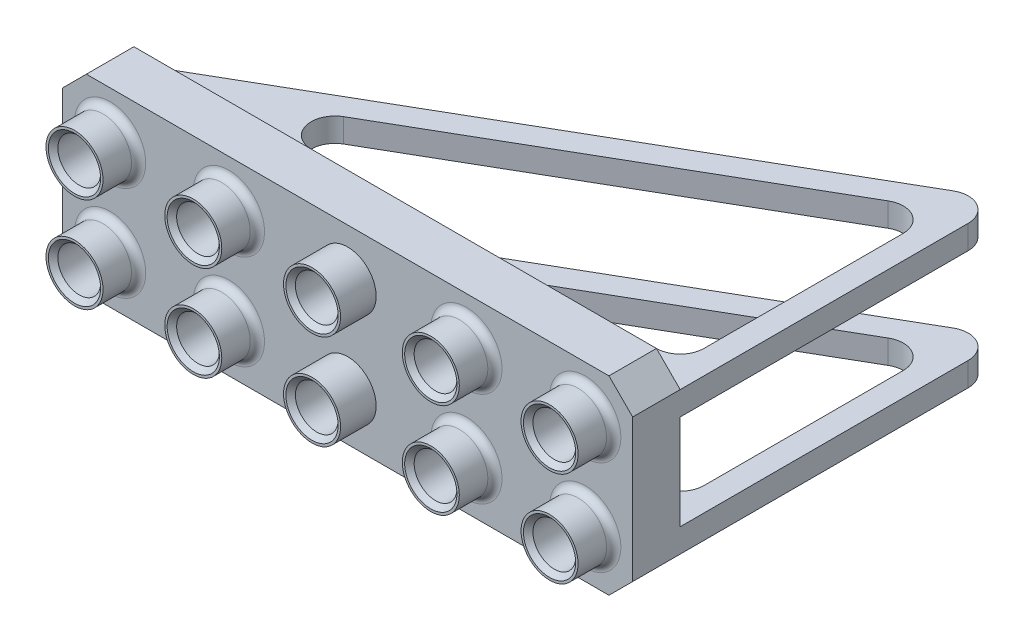
from build123d import *

# Parameters (mm, degrees)
SKETCH_1_W          = 240
SKETCH_1_H          = 80
EXTRUDE_1_DEPTH     = 20
SKETCH_2_R          = 12
SKETCH_2_R_2        = 9
EXTRUDE_2_DEPTH     = 15
CUT_EXTRUDE_START   = -15
SKETCH_3_R          = 9
CUT_EXTRUDE_1_DEPTH = 15
CHAMFER_1_SIZE      = 10
FILLET_1_R          = 3
CHAMFER_2_SIZE      = 2
EXTRUDE_START       = -10
EXTRUDE_4_DEPTH     = 10
FILLET_3_R          = 10


with BuildPart() as part:
    # 草图1 → 凸台-拉伸1 (new body)
    with BuildSketch(Plane.XY):
        Rectangle(SKETCH_1_W, SKETCH_1_H)
    extrude(amount=EXTRUDE_1_DEPTH)

    # 草图2 → 凸台-拉伸2 (add)
    # profile 1 of 10: a face of its own
    with BuildSketch(Plane.XY.offset(20)):
        with Locations((-100, 20)):
            Circle(SKETCH_2_R)
        with Locations((-100, 20)):
            Circle(SKETCH_2_R_2, mode=Mode.SUBTRACT)
    # profile 2 of 10: a face of its own
    with BuildSketch(Plane.XY.offset(20)):
        with Locations((-50, 20)):
            Circle(SKETCH_2_R)
        with Locations((-50, 20)):
            Circle(SKETCH_2_R_2, mode=Mode.SUBTRACT)
    # profile 3 of 10: a face of its own
    with BuildSketch(Plane.XY.offset(20)):
        with Locations((0, 20)):
            Circle(SKETCH_2_R)
        with Locations((0, 20)):
            Circle(SKETCH_2_R_2, mode=Mode.SUBTRACT)
    # profile 4 of 10: a face of its own
    with BuildSketch(Plane.XY.offset(20)):
        with Locations((50, 20)):
            Circle(SKETCH_2_R)
        with Locations((50, 20)):
            Circle(SKETCH_2_R_2, mode=Mode.SUBTRACT)
    # profile 5 of 10: a face of its own
    with BuildSketch(Plane.XY.offset(20)):
        with Locations((100, 20)):
            Circle(SKETCH_2_R)
        with Locations((100, 20)):
            Circle(SKETCH_2_R_2, mode=Mode.SUBTRACT)
    # profile 6 of 10: a face of its own
    with BuildSketch(Plane.XY.offset(20)):
        with Locations((-50, -20)):
            Circle(SKETCH_2_R)
        with Locations((-50, -20)):
            Circle(SKETCH_2_R_2, mode=Mode.SUBTRACT)
    # profile 7 of 10: a face of its own
    with BuildSketch(Plane.XY.offset(20)):
        with Locations((0, -20)):
            Circle(SKETCH_2_R)
        with Locations((0, -20)):
            Circle(SKETCH_2_R_2, mode=Mode.SUBTRACT)
    # profile 8 of 10: a face of its own
    with BuildSketch(Plane.XY.offset(20)):
        with Locations((50, -20)):
            Circle(SKETCH_2_R)
        with Locations((50, -20)):
            Circle(SKETCH_2_R_2, mode=Mode.SUBTRACT)
    # profile 9 of 10: a face of its own
    with BuildSketch(Plane.XY.offset(20)):
        with Locations((100, -20)):
            Circle(SKETCH_2_R)
        with Locations((100, -20)):
            Circle(SKETCH_2_R_2, mode=Mode.SUBTRACT)
    # profile 10 of 10: a face of its own
    with BuildSketch(Plane.XY.offset(20)):
        with Locations((-100, -20)):
            Circle(SKETCH_2_R)
        with Locations((-100, -20)):
            Circle(SKETCH_2_R_2, mode=Mode.SUBTRACT)
    extrude(amount=EXTRUDE_2_DEPTH)

    # 草图3 → 切除-拉伸1 (cut)
    with BuildSketch(Plane.XY.offset(20).offset(CUT_EXTRUDE_START)):
        with Locations((-100, 20)):
            Circle(SKETCH_3_R)
        with Locations((-50, 20)):
            Circle(SKETCH_3_R)
        with Locations((0, 20)):
            Circle(SKETCH_3_R)
        with Locations((50, 20)):
            Circle(SKETCH_3_R)
        with Locations((100, 20)):
            Circle(SKETCH_3_R)
        with Locations((-50, -20)):
            Circle(SKETCH_3_R)
        with Locations((0, -20)):
            Circle(SKETCH_3_R)
        with Locations((50, -20)):
            Circle(SKETCH_3_R)
        with Locations((100, -20)):
            Circle(SKETCH_3_R)
        with Locations((-100, -20)):
            Circle(SKETCH_3_R)
    extrude(amount=CUT_EXTRUDE_1_DEPTH, mode=Mode.SUBTRACT)

    # 倒角1
    chamfer_1_edges = [part.edges().sort_by_distance(p)[0] for p in [
        (120, 40, 10),
        (120, -40, 10),
        (-120, -40, 10),
        (-120, 40, 10),
    ]]
    chamfer(chamfer_1_edges, length=CHAMFER_1_SIZE)

    # 圆角1
    fillet_1_edges = [part.edges().sort_by_distance(p)[0] for p in [
        (-112, 20, 20),
        (-109, -20, 5),
        (91, -20, 5),
        (41, -20, 5),
        (-9, -20, 5),
        (-59, -20, 5),
        (91, 20, 5),
        (41, 20, 5),
        (-9, 20, 5),
        (-59, 20, 5),
        (-109, 20, 5),
        (-62, 20, 20),
        (38, 20, 20),
        (88, 20, 20),
        (-62, -20, 20),
        (38, -20, 20),
        (88, -20, 20),
        (-112, -20, 20),
    ]]
    fillet(fillet_1_edges, radius=FILLET_1_R)

    # 倒角2
    chamfer_2_edges = [part.edges().sort_by_distance(p)[0] for p in [
        (91, -20, 35),
        (41, -20, 35),
        (-9, -20, 35),
        (-59, -20, 35),
        (-109, -20, 35),
        (91, 20, 35),
        (41, 20, 35),
        (-9, 20, 35),
        (-59, 20, 35),
        (-109, 20, 35),
    ]]
    chamfer(chamfer_2_edges, length=CHAMFER_2_SIZE)

    # 草图5 → 凸台-拉伸4 (add)
    with BuildSketch(Plane(origin=(0, 40, 0), x_dir=(1, 0, 0), z_dir=(0, 1, 0)).offset(EXTRUDE_START)):
        Polygon((-120, 0), (120, 138.564064606), (120, 0), align=None)
        Polygon((110, 121.24355653), (110, 10), (-82.679491924, 10), align=None, mode=Mode.SUBTRACT)
    extrude_4 = extrude(amount=-EXTRUDE_4_DEPTH)

    # 镜向2: 凸台-拉伸4 across plane
    add(extrude_4.mirror(Plane.ZX))

    # 圆角3
    fillet_3_edges = [part.edges().sort_by_distance(p)[0] for p in [
        (120, -25, -138.564064606),
        (120, 25, -138.564064606),
        (-82.679491924, -25, -10),
        (110, -25, -121.24355653),
        (110, -25, -10),
        (-82.679491924, 25, -10),
        (110, 25, -121.24355653),
        (110, 25, -10),
    ]]
    fillet(fillet_3_edges, radius=FILLET_3_R)


solid = part.part
